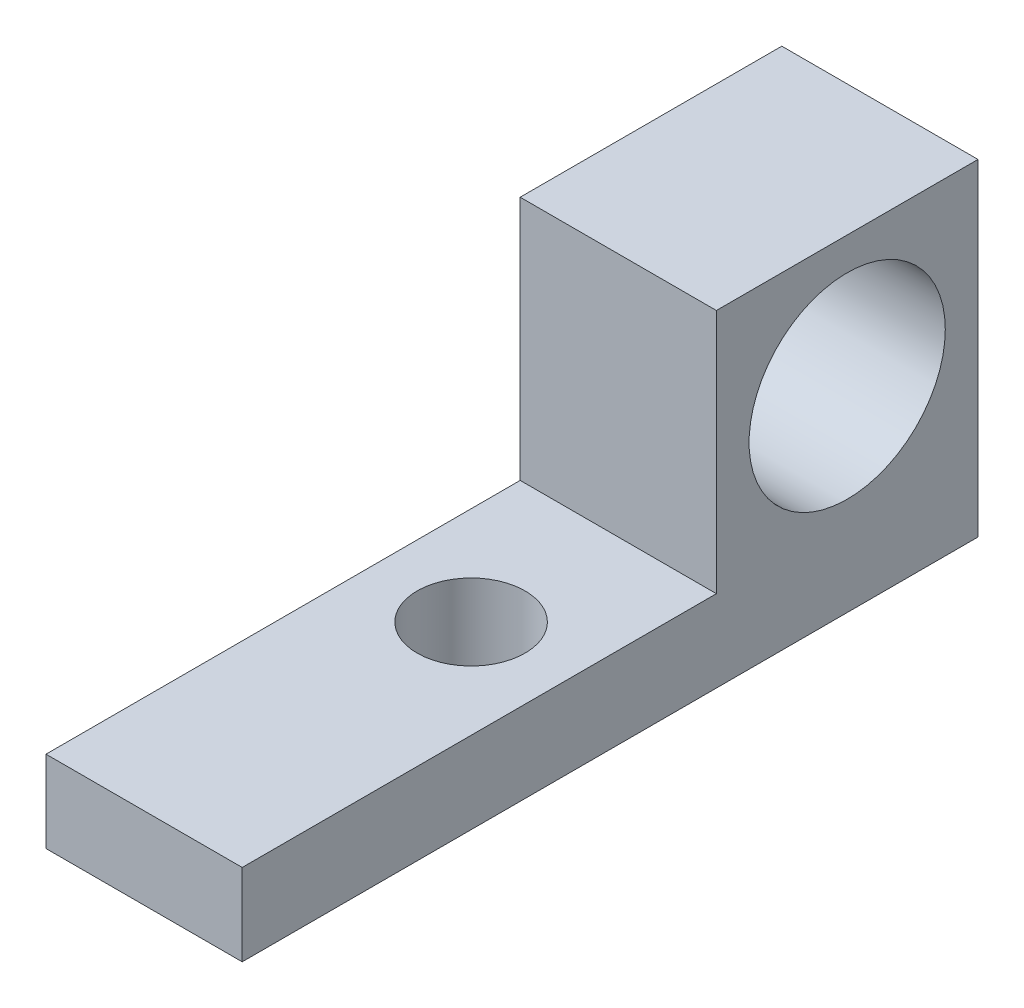
from build123d import *

# Parameters (mm, degrees)
SKETCH1_R            = 6
BOSS_EXTRUDE1_DEPTH  = 12
M6_CLEARANCE_HOLE1_D = 6.6


with BuildPart() as part:
    # Sketch1 → Boss-Extrude1 (new body)
    with BuildSketch(Plane(origin=(0, 0, 0), x_dir=(0, 0, -1), z_dir=(1, 0, 0))):
        Polygon((0, 0), (45, 0), (45, 20), (29, 20), (29, 5), (0, 5), align=None)
        with Locations((37, 12)):
            Circle(SKETCH1_R, mode=Mode.SUBTRACT)
    extrude(amount=BOSS_EXTRUDE1_DEPTH)

    # M6 Clearance Hole1 (through all)
    with Locations(Plane(origin=(0, 5, 0), x_dir=(-1, 0, 0), z_dir=(0, 1, 0))):
        with Locations((-6, -20)):
            Hole(M6_CLEARANCE_HOLE1_D / 2)


solid = part.part
